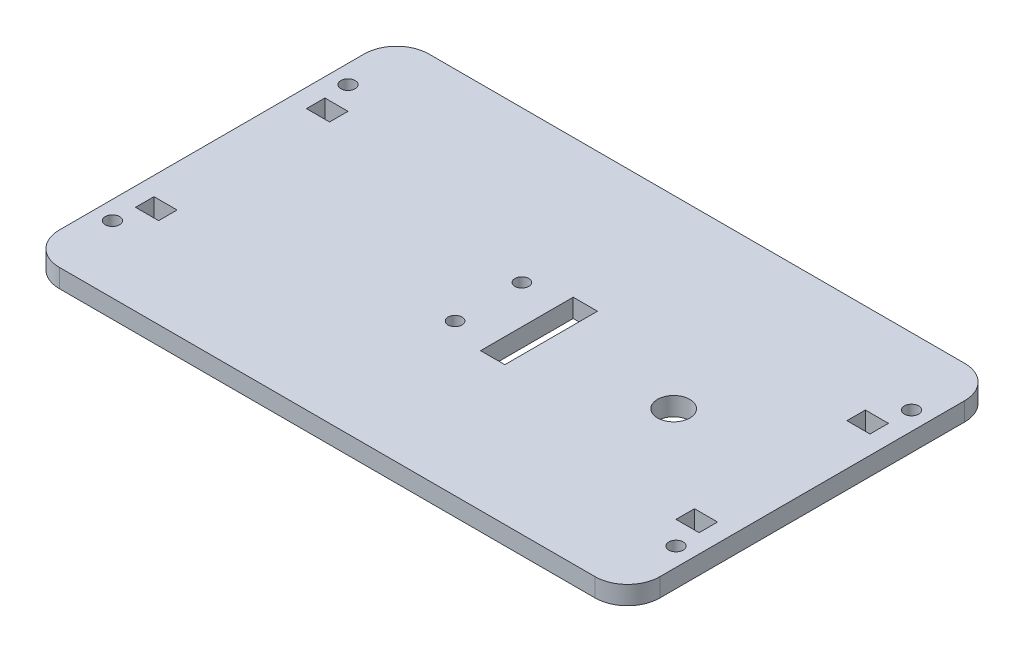
from build123d import *

# Parameters (mm, degrees)
SKETCH1_R           = 1.55
SKETCH1_R_2         = 1.5
SKETCH1_R_3         = 3.5
SKETCH1_W           = 5
SKETCH1_H           = 4
SKETCH1_W_2         = 5.253269852
SKETCH1_H_2         = 20.055
BOSS_EXTRUDE1_DEPTH = 4


with BuildPart() as part:
    # Sketch1 → Boss-Extrude1 (new body)
    with BuildSketch(Plane(origin=(0, 0, 0), x_dir=(1, 0, 0), z_dir=(0, 1, 0))):
        with BuildLine():
            Line((-58, -40), (58, -40))
            ThreePointArc((58, -40), (62.949747468, -37.949747468), (65, -33))
            Line((65, -33), (65, 33))
            ThreePointArc((65, 33), (62.949747468, 37.949747468), (58, 40))
            Line((58, 40), (-58, 40))
            ThreePointArc((-58, 40), (-62.949747468, 37.949747468), (-65, 33))
            Line((-65, 33), (-65, -33))
            ThreePointArc((-65, -33), (-62.949747468, -37.949747468), (-58, -40))
        make_face()
        with Locations(Location((61, 25.5, 0), (0, 0, 270))):
            Circle(SKETCH1_R, mode=Mode.SUBTRACT)
        with Locations(Location((61, -25.5, 0), (0, 0, 90))):
            Circle(SKETCH1_R, mode=Mode.SUBTRACT)
        with Locations(Location((-61, -25.5, 0), (0, 0, 270))):
            Circle(SKETCH1_R, mode=Mode.SUBTRACT)
        with Locations(Location((-61, 25.5, 0), (0, 0, 90))):
            Circle(SKETCH1_R, mode=Mode.SUBTRACT)
        with Locations(Location((-5.1, -7.2275, 0), (0, 0, 270))):
            Circle(SKETCH1_R_2, mode=Mode.SUBTRACT)
        with Locations(Location((-5.1, 7.2275, 0), (0, 0, 270))):
            Circle(SKETCH1_R_2, mode=Mode.SUBTRACT)
        with Locations(Location((35, 0, 0), (0, 0, 270))):
            Circle(SKETCH1_R_3, mode=Mode.SUBTRACT)
        with Locations((58.5, 18.5)):
            Rectangle(SKETCH1_W, SKETCH1_H, mode=Mode.SUBTRACT)
        with Locations((58.5, -18.5)):
            Rectangle(SKETCH1_W, SKETCH1_H, mode=Mode.SUBTRACT)
        with Locations((-58.5, -18.5)):
            Rectangle(SKETCH1_W, SKETCH1_H, mode=Mode.SUBTRACT)
        with Locations((-58.5, 18.5)):
            Rectangle(SKETCH1_W, SKETCH1_H, mode=Mode.SUBTRACT)
        with Locations((5.848955237, 0)):
            Rectangle(SKETCH1_W_2, SKETCH1_H_2, mode=Mode.SUBTRACT)
    extrude(amount=BOSS_EXTRUDE1_DEPTH)


solid = part.part
